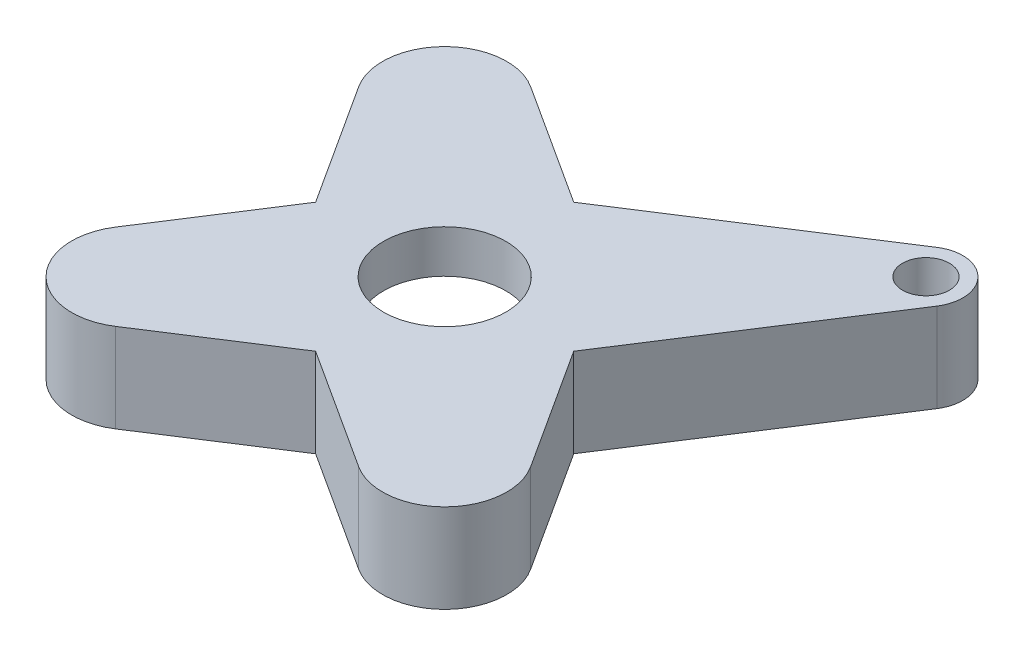
from build123d import *

# Parameters (mm, degrees)
SKETCH1_R           = 4.572
SKETCH1_R_2         = 1.75
BOSS_EXTRUDE1_DEPTH = 3.2004
BOSS_EXTRUDE2_START = -3.429
SKETCH1_3_R         = 1.75
BOSS_EXTRUDE2_DEPTH = 3.429


with BuildPart() as part:
    # Sketch1 → Boss-Extrude1 (new body)
    with BuildSketch(Plane(origin=(0, 0, 0), x_dir=(1, 0, 0), z_dir=(0, 1, 0))):
        with BuildLine():
            Line((15.494618326, -9.079673628), (9.632116129, 0))
            Line((9.632116129, 0), (20.267125172, 16.471194022))
            ThreePointArc((20.267125172, 16.471194022), (19.901971998, 19.901971998), (16.471194022, 20.267125172))
            Line((16.471194022, 20.267125172), (0, 9.632116129))
            Line((0, 9.632116129), (-9.079673628, 15.494618326))
            ThreePointArc((-9.079673628, 15.494618326), (-14.877526676, 14.877526676), (-15.494618326, 9.079673628))
            Line((-15.494618326, 9.079673628), (-9.632116129, 0))
            Line((-9.632116129, 0), (-15.494618326, -9.079673628))
            ThreePointArc((-15.494618326, -9.079673628), (-14.877526676, -14.877526676), (-9.079673628, -15.494618326))
            Line((-9.079673628, -15.494618326), (0, -9.632116129))
            Line((0, -9.632116129), (9.079673628, -15.494618326))
            ThreePointArc((9.079673628, -15.494618326), (14.877526676, -14.877526676), (15.494618326, -9.079673628))
        make_face()
        Circle(SKETCH1_R, mode=Mode.SUBTRACT)
        with Locations((17.960512242, 17.960512242)):
            Circle(SKETCH1_R_2, mode=Mode.SUBTRACT)
    extrude(amount=BOSS_EXTRUDE1_DEPTH)

    # Sketch1<3> → Boss-Extrude2 (add)
    with BuildSketch(Plane(origin=(0, 0, 0), x_dir=(1, 0, 0), z_dir=(0, 1, 0)).offset(BOSS_EXTRUDE2_START)):
        with BuildLine():
            Line((15.494618326, -9.079673628), (9.632116129, 0))
            Line((9.632116129, 0), (15.494618326, 9.079673628))
            Line((15.494618326, 9.079673628), (20.267125172, 16.471194022))
            ThreePointArc((20.267125172, 16.471194022), (19.901971998, 19.901971998), (16.471194022, 20.267125172))
            Line((16.471194022, 20.267125172), (9.079673628, 15.494618326))
            Line((9.079673628, 15.494618326), (0, 9.632116129))
            Line((0, 9.632116129), (-9.079673628, 15.494618326))
            ThreePointArc((-9.079673628, 15.494618326), (-14.877526676, 14.877526676), (-15.494618326, 9.079673628))
            Line((-15.494618326, 9.079673628), (-9.632116129, 0))
            Line((-9.632116129, 0), (-15.494618326, -9.079673628))
            ThreePointArc((-15.494618326, -9.079673628), (-14.877526676, -14.877526676), (-9.079673628, -15.494618326))
            Line((-9.079673628, -15.494618326), (0, -9.632116129))
            Line((0, -9.632116129), (9.079673628, -15.494618326))
            ThreePointArc((9.079673628, -15.494618326), (14.877526676, -14.877526676), (15.494618326, -9.079673628))
        make_face()
        with BuildLine():
            Line((13.894226547, 10.113003756), (8.023816422, 1.021082558))
            ThreePointArc((8.023816422, 1.021082558), (7.408645479, 0), (8.023816422, -1.021082558))
            Line((8.023816422, -1.021082558), (13.894226547, -10.113003756))
            ThreePointArc((13.894226547, -10.113003756), (13.530488258, -13.530488258), (10.113003756, -13.894226547))
            Line((10.113003756, -13.894226547), (1.021082558, -8.023816422))
            ThreePointArc((1.021082558, -8.023816422), (0, -7.408645479), (-1.021082558, -8.023816422))
            Line((-1.021082558, -8.023816422), (-10.113003756, -13.894226547))
            ThreePointArc((-10.113003756, -13.894226547), (-13.530488258, -13.530488258), (-13.894226547, -10.113003756))
            Line((-13.894226547, -10.113003756), (-8.023816422, -1.021082558))
            ThreePointArc((-8.023816422, -1.021082558), (-7.408645479, 0), (-8.023816422, 1.021082558))
            Line((-8.023816422, 1.021082558), (-13.894226547, 10.113003756))
            ThreePointArc((-13.894226547, 10.113003756), (-13.530488258, 13.530488258), (-10.113003756, 13.894226547))
            Line((-10.113003756, 13.894226547), (-1.021082558, 8.023816422))
            ThreePointArc((-1.021082558, 8.023816422), (0, 7.408645479), (1.021082558, 8.023816422))
            Line((1.021082558, 8.023816422), (10.113003756, 13.894226547))
            ThreePointArc((10.113003756, 13.894226547), (13.530488258, 13.530488258), (13.894226547, 10.113003756))
        make_face(mode=Mode.SUBTRACT)
        with Locations((17.960512242, 17.960512242)):
            Circle(SKETCH1_3_R, mode=Mode.SUBTRACT)
    extrude(amount=BOSS_EXTRUDE2_DEPTH)


solid = part.part
